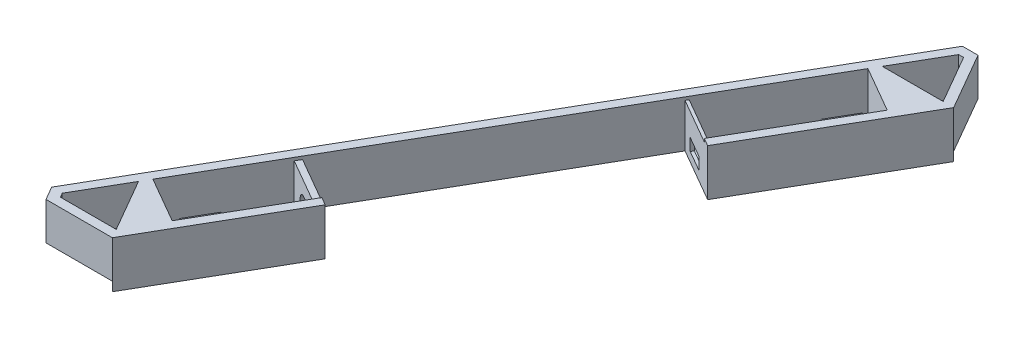
from build123d import *

# Parameters (mm, degrees)
BOSS_EXTRUDE2_DEPTH = 15.38
BOSS_EXTRUDE3_DEPTH = 1
BOSS_EXTRUDE4_DEPTH = 14.38
CUT_EXTRUDE1_DEPTH  = 8.26
SKETCH12_R          = 3.5
CUT_EXTRUDE2_DEPTH  = 8.26
CUT_EXTRUDE3_DEPTH  = 3
SKETCH16_W          = 10
SKETCH16_H          = 2
CUT_EXTRUDE4_DEPTH  = 3


with BuildPart() as part:
    # Sketch1 → Boss-Extrude2 (new body)
    with BuildSketch(Plane(origin=(0, 0, 0), x_dir=(1, 0, 0), z_dir=(0, 1, 0))):
        Polygon((-33.232050802, 130.626242439), (-11.732050802, 167.865334802), (3.267949197, 159.205080764), (-18.232050803, 121.965988402), (-18.732050803, 121.099962998), (-16.133974592, 119.599962998), (13.464101619, 170.865334801), (2.556624332, 189.757639644), (-2.556624322, 189.757639644), (-112.11324865, 2e-09), (-109.556624323, -4.428203228), (-87.74166975, -4.428203228), (-62.14359354, 39.908965344), (-64.74166975, 41.408965344), (-65.74166975, 39.676914536), (-82.74166975, 10.232050807), (-97.741669749, 18.892304845), (-80.741669749, 48.337168573), (-79.741669749, 50.069219381), (-33.732050802, 129.760217035), align=None)
        Polygon((-89.473720558, -1.42820323), (-107.824573519, -1.42820323), (-108.649147039, 0), (-99.473720558, 15.892304845), align=None, mode=Mode.SUBTRACT)
        Polygon((-9.999999996, 170.865334801), (-0.824573515, 186.757639646), (0.824573508, 186.757639646), (10.000000004, 170.865334801), align=None, mode=Mode.SUBTRACT)
    extrude(amount=BOSS_EXTRUDE2_DEPTH)

    # Sketch1<11> → Boss-Extrude3 (add)
    with BuildSketch(Plane(origin=(0, 0, 0), x_dir=(1, 0, 0), z_dir=(0, 1, 0))):
        Polygon((3.267949197, 159.205080764), (-11.732050802, 167.865334802), (-33.232050802, 130.626242439), (-18.232050803, 121.965988402), align=None)
        Polygon((-65.74166975, 39.676914536), (-80.741669749, 48.337168573), (-97.741669749, 18.892304845), (-82.74166975, 10.232050807), align=None)
    extrude(amount=BOSS_EXTRUDE3_DEPTH)

    # Sketch1<12> → Boss-Extrude4 (add)
    with BuildSketch(Plane(origin=(0, 0, 0), x_dir=(1, 0, 0), z_dir=(0, 1, 0))):
        Polygon((-18.232050803, 121.965988402), (-33.232050802, 130.626242439), (-33.732050802, 129.760217035), (-18.732050803, 121.099962998), align=None)
        Polygon((-64.74166975, 41.408965344), (-79.741669749, 50.069219381), (-80.741669749, 48.337168573), (-65.74166975, 39.676914536), align=None)
    extrude(amount=BOSS_EXTRUDE4_DEPTH)

    # Sketch10 → Cut-Extrude1 (cut)
    with BuildSketch(Plane(origin=(47.754809476, 0, -82.713756318), x_dir=(0.8660254037844418, 0, 0.49999999999999456), z_dir=(-0.4999999999999946, 0, 0.8660254037844419))):
        Polygon((-85.432921433, 3), (-81.432921433, 3), (-81.432921433, 7), (-89.432921433, 7), (-89.432921433, 3), align=None)
    extrude(amount=-CUT_EXTRUDE1_DEPTH, mode=Mode.SUBTRACT)

    # Sketch12 → Cut-Extrude2 (cut)
    with BuildSketch(Plane(origin=(1.745190528, 0, -3.022758664), x_dir=(-0.866025403784436, 0, -0.5000000000000047), z_dir=(0.5000000000000047, 0, -0.866025403784436))):
        with Locations((85.432921433, 6.5)):
            Circle(SKETCH12_R)
    extrude(amount=-CUT_EXTRUDE2_DEPTH, mode=Mode.SUBTRACT)

    # Sketch15 → Cut-Extrude3 (cut)
    with BuildSketch(Plane.XZ):
        Polygon((-87.74166975, 4.428203228), (-109.556624323, 4.428203228), (-112.11324865, -2e-09), (-101.205771363, -18.892304845), align=None)
        Polygon((13.464101619, -170.865334801), (2.556624332, -189.757639644), (-2.556624322, -189.757639644), (-13.464101609, -170.865334801), align=None)
    extrude(amount=-CUT_EXTRUDE3_DEPTH, mode=Mode.SUBTRACT)

    # Sketch16 → Cut-Extrude4 (cut)
    with BuildSketch(Plane(origin=(-84.084936489, 0, -48.546460716), x_dir=(-0.4999999999999999, 0, 0.8660254037844386), z_dir=(-0.8660254037844387, 0, -0.49999999999999994))):
        with Locations((-133.242624333, 2)):
            Rectangle(SKETCH16_W, SKETCH16_H)
        with Locations((21.128966724, 2)):
            Rectangle(SKETCH16_W, SKETCH16_H)
    extrude(amount=-CUT_EXTRUDE4_DEPTH, mode=Mode.SUBTRACT)


solid = part.part
